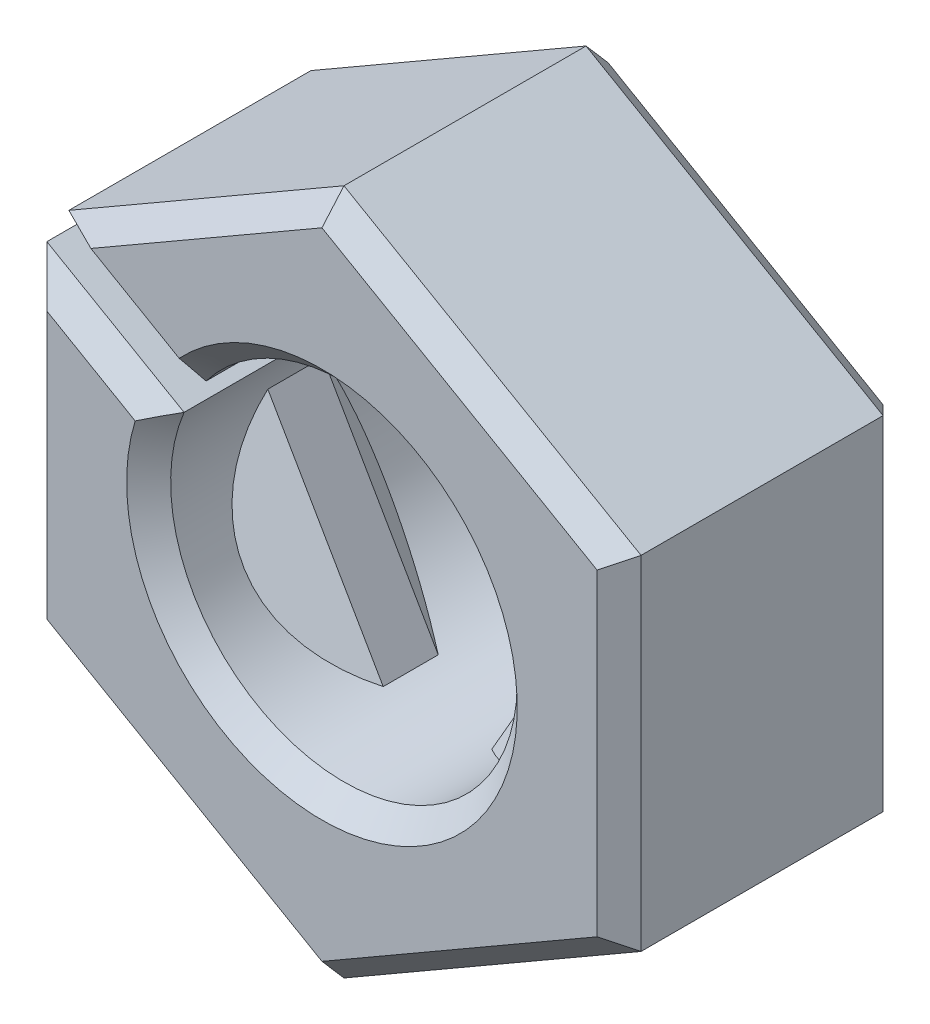
from build123d import *

# Parameters (mm, degrees)
SKETCH1_R                   = 1.575
BOSS_EXTRUDE1_DEPTH         = 1.3
CLIP_REACH                  = 6.324
CLIP_END_RADIUS             = 1.575
CLIP_DIRECTION_2_REACH      = 6.324
CLIP_DIRECTION_2_END_RADIUS = 1.575
CLIPS_X3_COUNT              = 3
SPLIT_2_DEPTH               = 5.324349662
SPLIT_2_DEPTH_BACK          = 5.324349662
DEBURS_SIZE                 = 0.2


with BuildPart() as part:
    # Sketch1 → Boss-Extrude1 (new, symmetric)
    with BuildSketch(Plane.XY):
        Polygon((2.7, -1.558845727), (2.7, 1.558845727), (0, 3.117691454), (-2.7, 1.558845727), (-2.7, -1.558845727), (0, -3.117691454), align=None)
        Circle(SKETCH1_R, mode=Mode.SUBTRACT)
    extrude(amount=BOSS_EXTRUDE1_DEPTH, both=True)

    # Clip: up to this cylinder (the profile starts inside it)
    clip_end = Plane(origin=(0, 0, 0), z_dir=(0, 0, -1)) * Cylinder(CLIP_END_RADIUS, 16.798, mode=Mode.PRIVATE)
    # Sketch3 → Clip (add, up to the surface)
    with BuildSketch(Plane(origin=(0, 0, 0), x_dir=(0, 0, -1), z_dir=(1, 0, 0)), mode=Mode.PRIVATE) as clip_sk1:
        Polygon((-0.65, 1.575), (0.65, 1.575), (0.25, 1.175), (-0.25, 1.175), align=None)
    clip_tool1 = extrude(clip_sk1.sketch, amount=CLIP_REACH, mode=Mode.PRIVATE) & clip_end
    clip = clip_tool1.solids().sort_by_distance((0, 1.40463, 0))[0]
    add(clip)

    # Clip direction 2: up to this cylinder (the profile starts inside it)
    clip_direction_2_end = Plane(origin=(0, 0, 0), z_dir=(0, 0, -1)) * Cylinder(CLIP_DIRECTION_2_END_RADIUS, 16.798, mode=Mode.PRIVATE)
    # Sketch3 → Clip direction 2 (add, up to the surface)
    with BuildSketch(Plane(origin=(0, 0, 0), x_dir=(0, 0, -1), z_dir=(1, 0, 0)), mode=Mode.PRIVATE) as clip_direction_2_sk1:
        Polygon((-0.65, 1.575), (0.65, 1.575), (0.25, 1.175), (-0.25, 1.175), align=None)
    clip_direction_2_tool1 = extrude(clip_direction_2_sk1.sketch, amount=-CLIP_DIRECTION_2_REACH, mode=Mode.PRIVATE) & clip_direction_2_end
    clip_direction_2 = clip_direction_2_tool1.solids().sort_by_distance((0, 1.40463, 0))[0]
    add(clip_direction_2)
    clip = clip + clip_direction_2  # both directions under the feature's name, for the pattern or mirror that repeats it

    # Clips x3: Clip ×3 about axis
    clips_x3_axis = Axis((0, 0, 0), (0, 0, 1))
    for i in range(1, CLIPS_X3_COUNT):
        add(clip.rotate(clips_x3_axis, i * 360 / CLIPS_X3_COUNT))

    # Sketch4 → Split 2 (cut, two sides: drawn at the far end of the back side and taken through both)
    with BuildSketch(Plane.XY.offset(-SPLIT_2_DEPTH_BACK)):
        Polygon((-2.8, 1.385640646), (-0.1, -0.173205081), (0.1, 0.173205081), (-2.6, 1.732050808), align=None)
    extrude(amount=SPLIT_2_DEPTH + SPLIT_2_DEPTH_BACK, mode=Mode.SUBTRACT)

    # Deburs
    deburs_edges = [part.edges().sort_by_distance(p)[0] for p in [
        (1.35, 2.33826859, 1.3),
        (-1.25, 2.396003617, 1.3),
        (-1.35, -2.33826859, 1.3),
        (-0.310025509, -1.544185605, 1.3),
        (1.35, -2.33826859, 1.3),
        (-0.310025509, -1.544185605, -1.3),
        (-2.7, -0.115470054, -1.3),
        (-2.7, -0.115470054, 1.3),
        (-2.076474085, 0.967912764, -1.3),
        (-1.876474085, 1.314322926, 1.3),
        (-1.876474085, 1.314322926, -1.3),
        (-2.076474085, 0.967912764, 1.3),
        (-1.35, -2.33826859, -1.3),
        (-1.25, 2.396003617, -1.3),
        (1.35, 2.33826859, -1.3),
        (2.7, 0, -1.3),
        (1.35, -2.33826859, -1.3),
        (2.7, 0, 1.3),
    ]]
    chamfer(deburs_edges, length=DEBURS_SIZE)


solid = part.part
